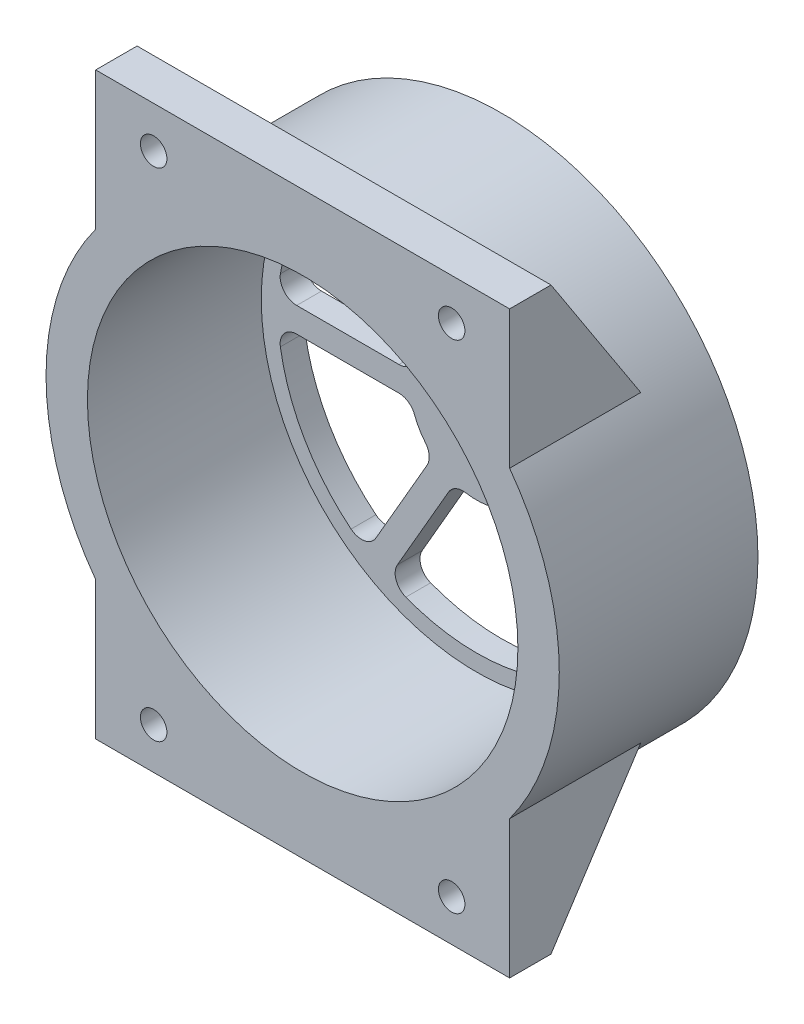
from build123d import *

# Parameters (mm, degrees)
BOSS_EXTRUDE1_DEPTH     = 5
RIB4_REACH              = 72.264
SKETCH3_WALL_W          = 162.412301062
SKETCH3_WALL_H          = 2
MIRROR2_COPY_1_REACH    = 72.264
MIRROR2_COPY_1_SKETCH_W = 162.412301062
MIRROR2_COPY_1_SKETCH_H = 2
CUT_EXTRUDE1_DEPTH      = 52.254268115
SKETCH5_R               = 1.6
CUT_EXTRUDE2_DEPTH      = 53.554733374


with BuildPart() as part:
    # Sketch1 → Revolve1 (revolve)
    with BuildSketch(Plane(origin=(0, 0, 0), x_dir=(0, 0, -1), z_dir=(1, 0, 0)), mode=Mode.PRIVATE) as revolve1_sk:
        Polygon((0, 0), (0, 31), (-24, 31), (-24, 26), (-3, 26), (-3, 0), align=None)
    revolve(revolve1_sk.sketch.rotate(Axis((0, 0, 0), (0, 0, 1)), 90), axis=Axis((0, 0, 0), (0, 0, 1)))

    # Sketch2 → Boss-Extrude1 (add)
    with BuildSketch(Plane.XY.offset(24)):
        with BuildLine():
            Line((25, 35), (-25, 35))
            Line((-25, 35), (-25, 18.33030278))
            ThreePointArc((-25, 18.33030278), (0, 31), (25, 18.33030278))
            Line((25, 18.33030278), (25, 35))
        make_face()
        with BuildLine():
            Line((25, -35), (25, -18.33030278))
            ThreePointArc((25, -18.33030278), (0, -31), (-25, -18.33030278))
            Line((-25, -18.33030278), (-25, -35))
            Line((-25, -35), (25, -35))
        make_face()
    extrude(amount=-BOSS_EXTRUDE1_DEPTH)

    # Sketch3 wall → Rib4 (add, up to next)
    with BuildSketch(Plane(origin=(25, 26.66515139, 13.579588783), x_dir=(0, -0.838316763898, -0.54518345845), z_dir=(0, 0.54518345845, -0.838316763898)), mode=Mode.PRIVATE) as rib4_sk1:
        with Locations((0, 1)):
            Rectangle(SKETCH3_WALL_W, SKETCH3_WALL_H)
    rib4_tool1 = extrude(rib4_sk1.sketch, amount=-RIB4_REACH, mode=Mode.PRIVATE) - part.part
    rib4 = rib4_tool1.solids().sort_by_distance((25, 26.66515139, 13.579588783))[0]
    add(rib4)

    # Mirror1: Rib4 across plane
    add(rib4.mirror(Plane.ZX))

    # Mirror2: Rib4 across plane
    add(rib4.mirror(Plane(origin=(0, 0, 0), x_dir=(0, 0, 1), z_dir=(1, 0, 0))))

    # Mirror2 copy 1 sketch → Mirror2 copy 1 (add, up to next)
    with BuildSketch(Plane(origin=(-25, -26.66515139, 13.579588783), x_dir=(0, 0.838316763898, -0.54518345845), z_dir=(0, -0.54518345845, -0.838316763898)), mode=Mode.PRIVATE) as mirror2_copy_1_sk1:
        with Locations((0, 1)):
            Rectangle(MIRROR2_COPY_1_SKETCH_W, MIRROR2_COPY_1_SKETCH_H)
    mirror2_copy_1_tool1 = extrude(mirror2_copy_1_sk1.sketch, amount=-MIRROR2_COPY_1_REACH, mode=Mode.PRIVATE) - part.part
    add(mirror2_copy_1_tool1.solids().sort_by_distance((-25, -26.66515139, 13.579588783))[0])

    # Sketch4 → Cut-Extrude1 (cut, through all)
    with BuildSketch(Plane.XY.offset(3)):
        with BuildLine():
            Line((-9.560865209, 19.559904306), (-3.384710393, 8.86249037))
            ThreePointArc((-3.384710393, 8.86249037), (-2.50559682, 8.053485651), (-1.322127668, 7.889992296))
            ThreePointArc((-1.322127668, 7.889992296), (0, 8), (1.322127668, 7.889992296))
            ThreePointArc((1.322127668, 7.889992296), (2.50559682, 8.053485651), (3.384710393, 8.86249037))
            Line((3.384710393, 8.86249037), (9.560865209, 19.559904306))
            ThreePointArc((9.560865209, 19.559904306), (9.713197693, 21.230053251), (8.540524801, 22.428986516))
            ThreePointArc((8.540524801, 22.428986516), (0, 24), (-8.540524801, 22.428986516))
            ThreePointArc((-8.540524801, 22.428986516), (-9.713197693, 21.230053251), (-9.560865209, 19.559904306))
        make_face()
        with BuildLine():
            Line((21.719806629, 1.5), (9.367496998, 1.5))
            ThreePointArc((9.367496998, 1.5), (8.227321572, 1.856832327), (7.493997598, 2.8))
            ThreePointArc((7.493997598, 2.8), (6.92820323, 4), (6.17186993, 5.089992296))
            ThreePointArc((6.17186993, 5.089992296), (5.721724752, 6.196653323), (5.982786604, 7.36249037))
            Line((5.982786604, 7.36249037), (12.15894142, 18.059904306))
            ThreePointArc((12.15894142, 18.059904306), (13.529166592, 19.02690258), (15.153809703, 18.610804697))
            ThreePointArc((15.153809703, 18.610804697), (20.784609691, 12), (23.694334504, 3.818181818))
            ThreePointArc((23.694334504, 3.818181818), (23.242364286, 2.203150671), (21.719806629, 1.5))
        make_face()
        with BuildLine():
            Line((12.15894142, -18.059904306), (5.982786604, -7.36249037))
            ThreePointArc((5.982786604, -7.36249037), (5.721724752, -6.196653323), (6.17186993, -5.089992296))
            ThreePointArc((6.17186993, -5.089992296), (6.92820323, -4), (7.493997598, -2.8))
            ThreePointArc((7.493997598, -2.8), (8.227321572, -1.856832327), (9.367496998, -1.5))
            Line((9.367496998, -1.5), (21.719806629, -1.5))
            ThreePointArc((21.719806629, -1.5), (23.242364286, -2.203150671), (23.694334504, -3.818181818))
            ThreePointArc((23.694334504, -3.818181818), (20.784609691, -12), (15.153809703, -18.610804697))
            ThreePointArc((15.153809703, -18.610804697), (13.529166592, -19.02690258), (12.15894142, -18.059904306))
        make_face()
        with BuildLine():
            Line((-9.560865209, -19.559904306), (-3.384710393, -8.86249037))
            ThreePointArc((-3.384710393, -8.86249037), (-2.50559682, -8.053485651), (-1.322127668, -7.889992296))
            ThreePointArc((-1.322127668, -7.889992296), (0, -8), (1.322127668, -7.889992296))
            ThreePointArc((1.322127668, -7.889992296), (2.50559682, -8.053485651), (3.384710393, -8.86249037))
            Line((3.384710393, -8.86249037), (9.560865209, -19.559904306))
            ThreePointArc((9.560865209, -19.559904306), (9.713197693, -21.230053251), (8.540524801, -22.428986516))
            ThreePointArc((8.540524801, -22.428986516), (0, -24), (-8.540524801, -22.428986516))
            ThreePointArc((-8.540524801, -22.428986516), (-9.713197693, -21.230053251), (-9.560865209, -19.559904306))
        make_face()
        with BuildLine():
            Line((-21.719806629, -1.5), (-9.367496998, -1.5))
            ThreePointArc((-9.367496998, -1.5), (-8.227321572, -1.856832327), (-7.493997598, -2.8))
            ThreePointArc((-7.493997598, -2.8), (-6.92820323, -4), (-6.17186993, -5.089992296))
            ThreePointArc((-6.17186993, -5.089992296), (-5.721724752, -6.196653323), (-5.982786604, -7.36249037))
            Line((-5.982786604, -7.36249037), (-12.15894142, -18.059904306))
            ThreePointArc((-12.15894142, -18.059904306), (-13.529166592, -19.02690258), (-15.153809703, -18.610804697))
            ThreePointArc((-15.153809703, -18.610804697), (-20.784609691, -12), (-23.694334504, -3.818181818))
            ThreePointArc((-23.694334504, -3.818181818), (-23.242364286, -2.203150671), (-21.719806629, -1.5))
        make_face()
        with BuildLine():
            Line((-12.15894142, 18.059904306), (-5.982786604, 7.36249037))
            ThreePointArc((-5.982786604, 7.36249037), (-5.721724752, 6.196653323), (-6.17186993, 5.089992296))
            ThreePointArc((-6.17186993, 5.089992296), (-6.92820323, 4), (-7.493997598, 2.8))
            ThreePointArc((-7.493997598, 2.8), (-8.227321572, 1.856832327), (-9.367496998, 1.5))
            Line((-9.367496998, 1.5), (-21.719806629, 1.5))
            ThreePointArc((-21.719806629, 1.5), (-23.242364286, 2.203150671), (-23.694334504, 3.818181818))
            ThreePointArc((-23.694334504, 3.818181818), (-20.784609691, 12), (-15.153809703, 18.610804697))
            ThreePointArc((-15.153809703, 18.610804697), (-13.529166592, 19.02690258), (-12.15894142, 18.059904306))
        make_face()
    extrude(amount=-CUT_EXTRUDE1_DEPTH, mode=Mode.SUBTRACT)

    # Sketch5 → Cut-Extrude2 (cut, through all)
    with BuildSketch(Plane.XY.offset(24)):
        with Locations((-18, 30)):
            Circle(SKETCH5_R)
        with Locations((18, 30)):
            Circle(SKETCH5_R)
        with Locations((18, -30)):
            Circle(SKETCH5_R)
        with Locations((-18, -30)):
            Circle(SKETCH5_R)
    extrude(amount=-CUT_EXTRUDE2_DEPTH, mode=Mode.SUBTRACT)


solid = part.part
